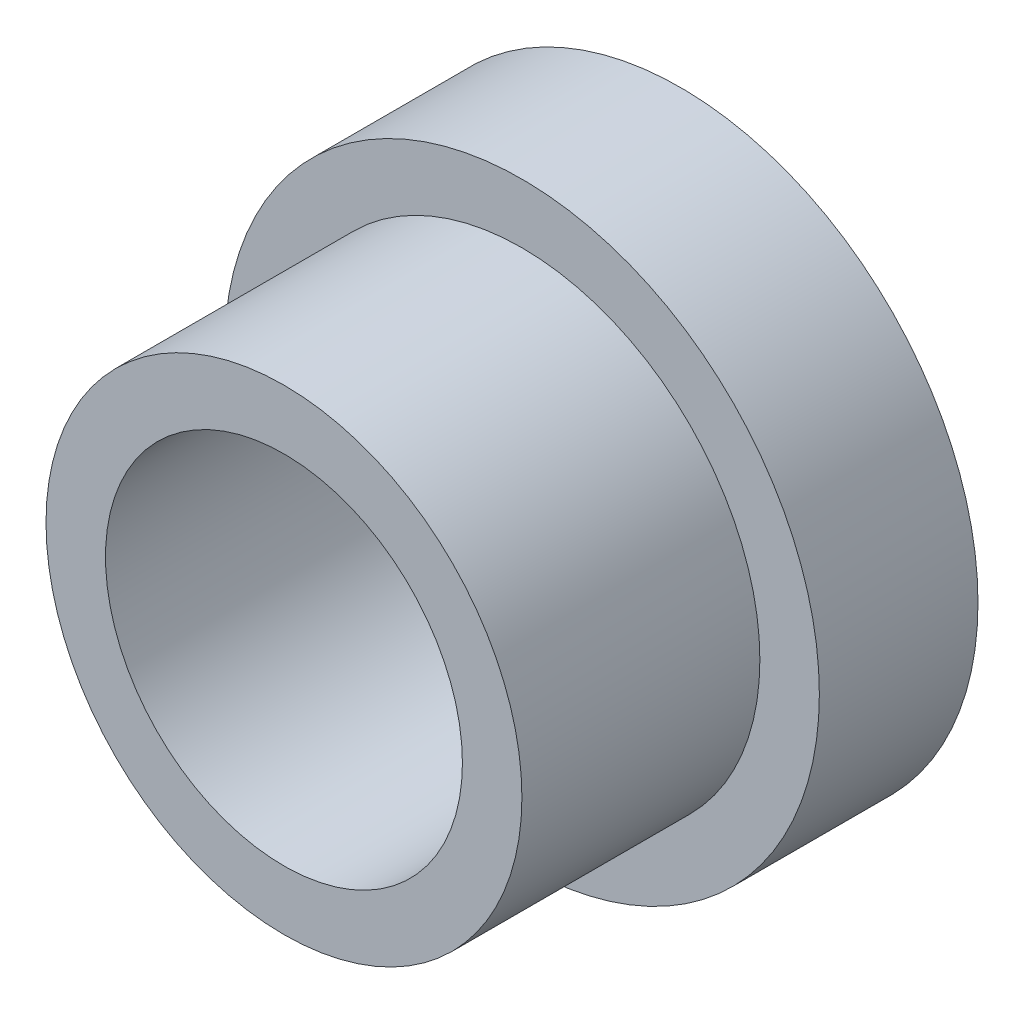
from build123d import *

# Parameters (mm, degrees)
ESQUISSE1_R             = 7.5
BOSS_EXTRU_1_DEPTH      = 4
ESQUISSE2_R             = 6
BOSS_EXTRU_2_DEPTH      = 6
ESQUISSE3_R             = 4.5
ENL_V_MAT_EXTRU_1_DEPTH = 15.577379737


with BuildPart() as part:
    # Esquisse1 → Boss.-Extru.1 (new body)
    with BuildSketch(Plane.XY):
        Circle(ESQUISSE1_R)
    extrude(amount=BOSS_EXTRU_1_DEPTH)

    # Esquisse2 → Boss.-Extru.2 (add)
    with BuildSketch(Plane.XY.offset(4)):
        Circle(ESQUISSE2_R)
    extrude(amount=BOSS_EXTRU_2_DEPTH)

    # Esquisse3 → Enlèv. mat.-Extru.1 (cut, through all)
    with BuildSketch(Plane.XY.offset(10)):
        Circle(ESQUISSE3_R)
    extrude(amount=-ENL_V_MAT_EXTRU_1_DEPTH, mode=Mode.SUBTRACT)


solid = part.part
